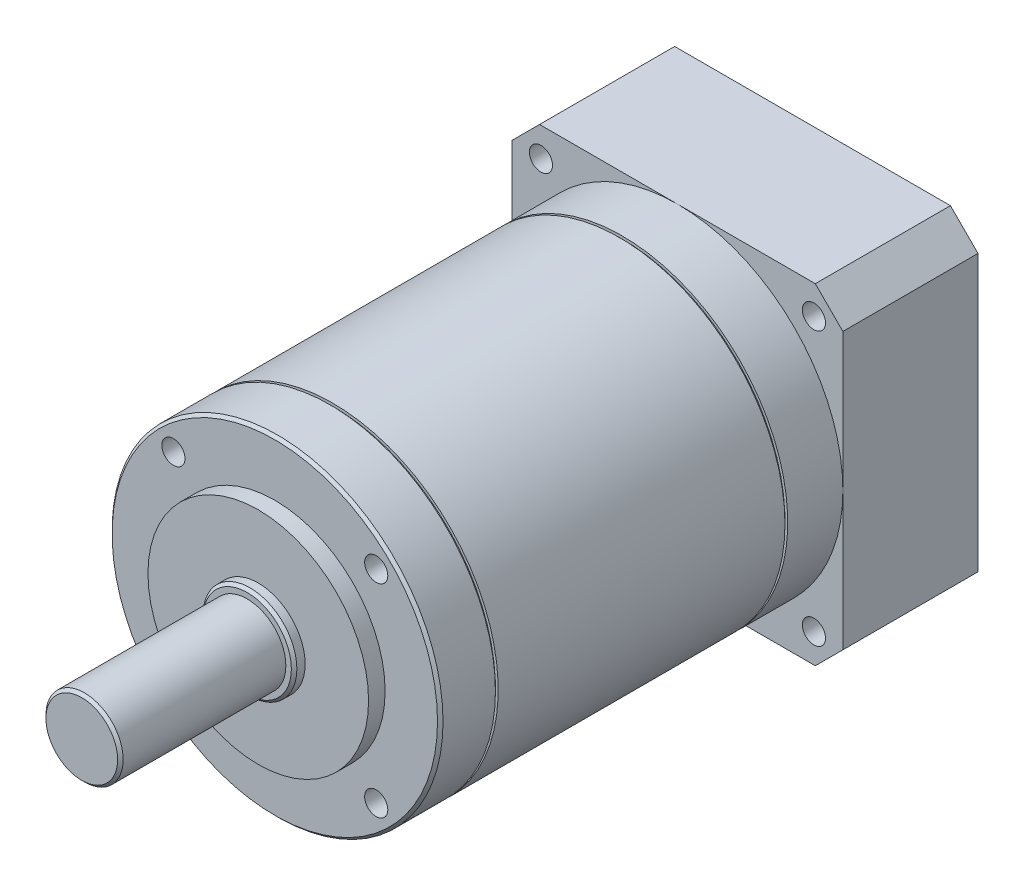
from build123d import *

# Parameters (mm, degrees)
SKETCH_1_W               = 60
SKETCH_1_H               = 60
EXTRUDE_1_DEPTH          = 24.5
CHAMFER_1_SIZE           = 5
SKETCH_2_R               = 30
EXTRUDE_2_DEPTH          = 73
SKETCH_3_W               = 0.5
SKETCH_3_H               = 3.76881343
SKETCH_4_R               = 7
EXTRUDE_3_DEPTH          = 35
SKETCH_5_R               = 20
EXTRUDE_4_DEPTH          = 3
SKETCH_6_R               = 8.5
EXTRUDE_5_DEPTH          = 2
PATTERN_CIRCULAR_1_COUNT = 4
HOLE_WIZARD_M5_2_D       = 4.2
PATTERN_CIRCULAR_2_COUNT = 4
CHAMFER_2_SIZE           = 0.5


with BuildPart() as part:
    # 草图1 → 凸台-拉伸1 (new body)
    with BuildSketch(Plane.XY):
        Rectangle(SKETCH_1_W, SKETCH_1_H)
    extrude(amount=EXTRUDE_1_DEPTH)

    # 倒角1
    chamfer_1_edges = [part.edges().sort_by_distance(p)[0] for p in [
        (30, -30, 12.25),
        (-30, -30, 12.25),
        (-30, 30, 12.25),
        (30, 30, 12.25),
    ]]
    chamfer(chamfer_1_edges, length=CHAMFER_1_SIZE)

    # 草图2 → 凸台-拉伸2 (add)
    with BuildSketch(Plane.XY.offset(24.5)):
        Circle(SKETCH_2_R)
    extrude(amount=EXTRUDE_2_DEPTH)

    # 草图3 → 切除-旋转1 (revolve, cut)
    with BuildSketch(Plane(origin=(0, 0, 0), x_dir=(0, 0, -1), z_dir=(1, 0, 0)), mode=Mode.PRIVATE) as cut_revolve_1_sk:
        with Locations((-87.25, 31.384406715)):
            Rectangle(SKETCH_3_W, SKETCH_3_H)
        with Locations((-34.75, 31.384406715)):
            Rectangle(SKETCH_3_W, SKETCH_3_H)
    revolve(cut_revolve_1_sk.sketch.rotate(Axis((0, 0, 0), (0, 0, 1)), 90), axis=Axis((0, 0, 0), (0, 0, 1)), mode=Mode.SUBTRACT)

    # 草图4 → 凸台-拉伸3 (add)
    with BuildSketch(Plane.XY.offset(97.5)):
        Circle(SKETCH_4_R)
    extrude(amount=EXTRUDE_3_DEPTH)

    # 草图5 → 凸台-拉伸4 (add)
    with BuildSketch(Plane.XY.offset(97.5)):
        Circle(SKETCH_5_R)
    extrude(amount=EXTRUDE_4_DEPTH)

    # 草图6 → 凸台-拉伸5 (add)
    with BuildSketch(Plane.XY.offset(100.5)):
        Circle(SKETCH_6_R)
    extrude(amount=EXTRUDE_5_DEPTH)

    # 草图7 → M5 螺纹孔1 (revolve, cut)
    with BuildSketch(Plane(origin=(18.384776311, 18.384776311, 97.5), x_dir=(0, -1, 0), z_dir=(1, 0, 0))):
        Polygon((0, 0), (0, 13.6618073), (2.1, 12.4), (2.1, 0), align=None)
    hole_wizard_m5_1 = revolve(axis=Axis((18.384776311, 18.384776311, 103.85), (0, 0, -1)), mode=Mode.SUBTRACT)

    # 阵列(圆周)1: M5 螺纹孔1 ×4 about axis
    pattern_circular_1_axis = Axis((0, 0, 0), (0, 0, 1))
    for i in range(1, PATTERN_CIRCULAR_1_COUNT):
        add(hole_wizard_m5_1.rotate(pattern_circular_1_axis, i * 360 / PATTERN_CIRCULAR_1_COUNT), mode=Mode.SUBTRACT)

    # M5 螺纹孔2 (through all)
    with Locations(Plane(origin=(0, 0, 0), x_dir=(-1, 0, 0), z_dir=(0, 0, -1))):
        with Locations((24.748737342, 24.748737342)):
            hole_wizard_m5_2 = Hole(HOLE_WIZARD_M5_2_D / 2)

    # 阵列(圆周)2: M5 螺纹孔2 ×4 about axis
    pattern_circular_2_axis = Axis((0, 0, 0), (0, 0, 1))
    for i in range(1, PATTERN_CIRCULAR_2_COUNT):
        add(hole_wizard_m5_2.rotate(pattern_circular_2_axis, i * 360 / PATTERN_CIRCULAR_2_COUNT), mode=Mode.SUBTRACT)

    # 倒角2
    chamfer_2_edges = [part.edges().sort_by_distance(p)[0] for p in [
        (-30, 0, 97.5),
        (-7, 0, 132.5),
        (-8.5, 0, 102.5),
    ]]
    chamfer(chamfer_2_edges, length=CHAMFER_2_SIZE)


solid = part.part
